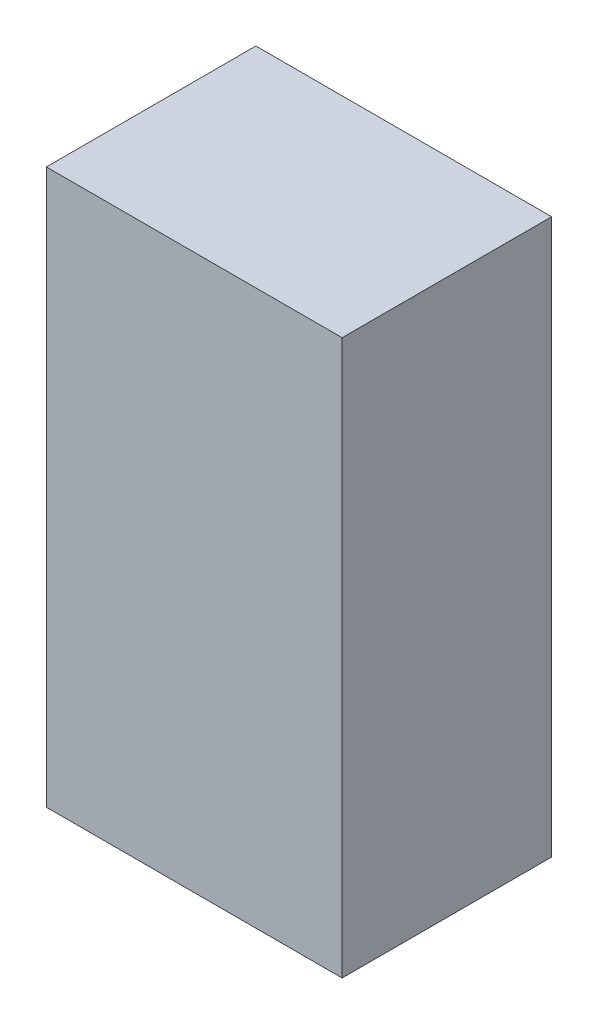
from build123d import *

# Parameters (mm, degrees)
SKETCH1_W           = 120
SKETCH1_H           = 225
BOSS_EXTRUDE1_DEPTH = 85


with BuildPart() as part:
    # Sketch1 → Boss-Extrude1 (new body)
    with BuildSketch(Plane.XY):
        Rectangle(SKETCH1_W, SKETCH1_H)
    extrude(amount=BOSS_EXTRUDE1_DEPTH)


solid = part.part
